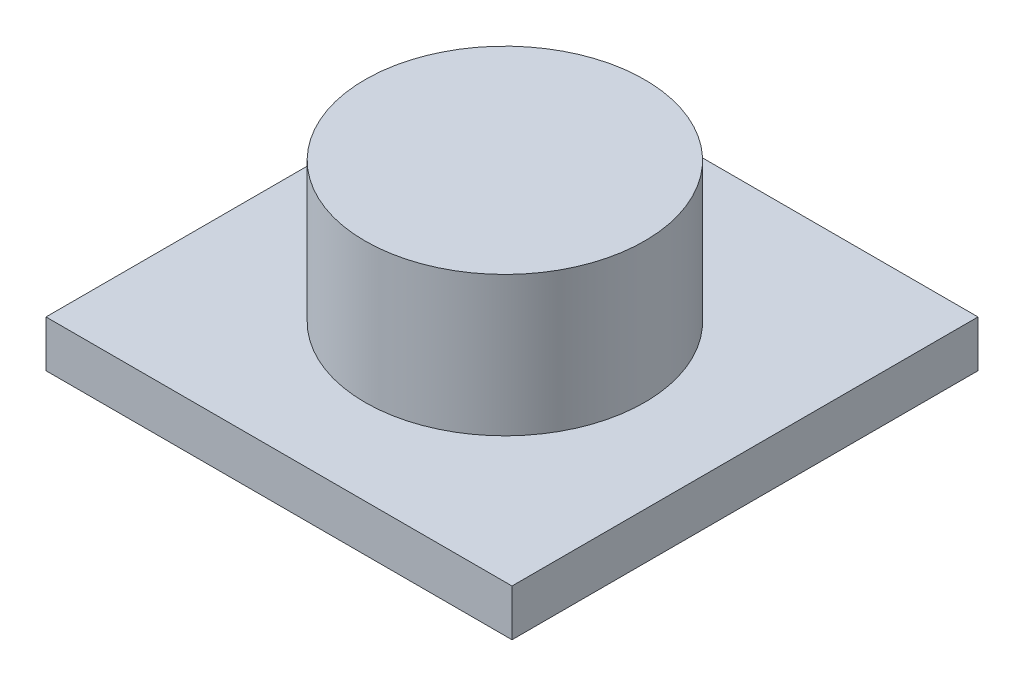
from build123d import *

# Parameters (mm, degrees)
SKETCH1_W           = 10
SKETCH1_H           = 10
BOSS_EXTRUDE1_DEPTH = 1
SKETCH2_R           = 3
BOSS_EXTRUDE2_DEPTH = 3


with BuildPart() as part:
    # Sketch1 → Boss-Extrude1 (new body)
    with BuildSketch(Plane(origin=(0, 0, 0), x_dir=(1, 0, 0), z_dir=(0, 1, 0))):
        with Locations((-0.01247434, -0.941486055)):
            Rectangle(SKETCH1_W, SKETCH1_H)
    extrude(amount=BOSS_EXTRUDE1_DEPTH)

    # Sketch2 → Boss-Extrude2 (add)
    with BuildSketch(Plane(origin=(0, 1, 0), x_dir=(1, 0, 0), z_dir=(0, 1, 0))):
        with Locations(Location((0, -1.107036753, 0), (0, 0, 270))):
            Circle(SKETCH2_R)
    extrude(amount=BOSS_EXTRUDE2_DEPTH)


solid = part.part
